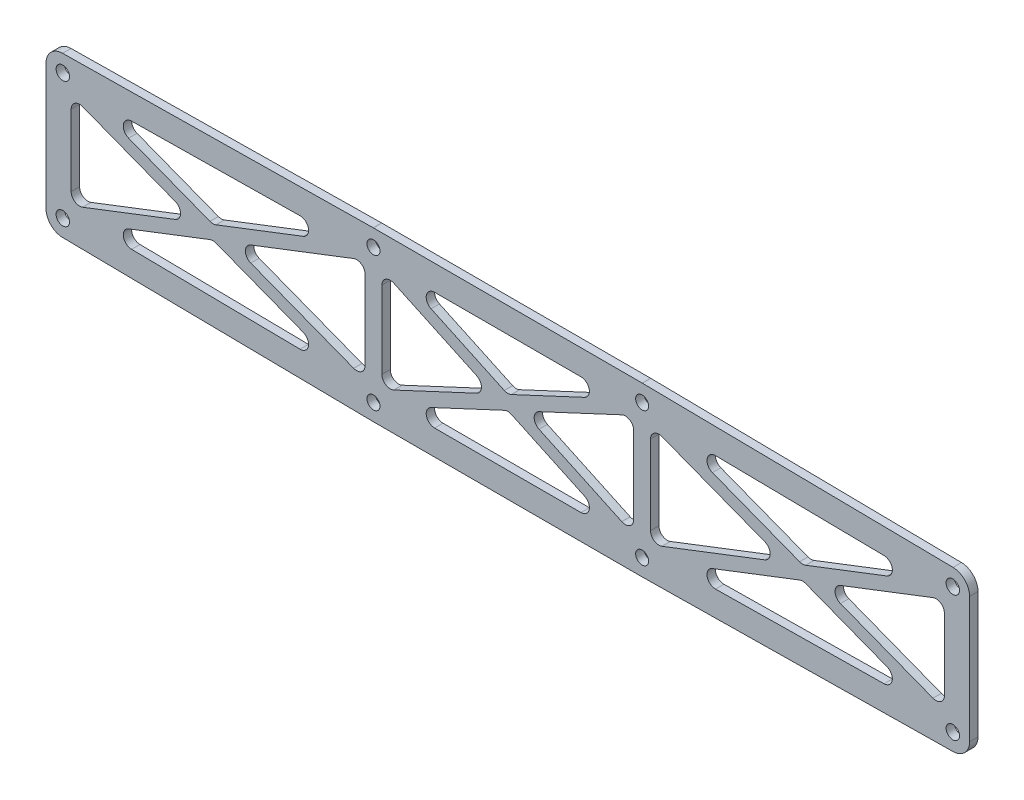
from build123d import *

# Parameters (mm, degrees)
SKETCH_1_W          = 232
SKETCH_1_H          = 52
EXTRUDE_1_DEPTH     = 2
SKETCH_3_R          = 1.55
CUT_EXTRUDE_2_DEPTH = 10
FILLET_1_R          = 3
SKETCH_8_R          = 1.6
CUT_EXTRUDE_6_DEPTH = 10
CUT_EXTRUDE_7_DEPTH = 5
CUT_EXTRUDE_8_DEPTH = 5
FILLET_2_R          = 2


with BuildPart() as part:
    # 草图1 → 凸台-拉伸1 (new body)
    with BuildSketch(Plane.XY):
        Rectangle(SKETCH_1_W, SKETCH_1_H)
    extrude(amount=EXTRUDE_1_DEPTH)

    # 草图3 → 切除-拉伸2 (cut)
    with BuildSketch(Plane.XY.offset(2)):
        with Locations((32, -16)):
            Circle(SKETCH_3_R)
        with Locations((32, 16)):
            Circle(SKETCH_3_R)
        with Locations((-32, 16)):
            Circle(SKETCH_3_R)
        with Locations((-32, -16)):
            Circle(SKETCH_3_R)
    extrude(amount=-CUT_EXTRUDE_2_DEPTH, mode=Mode.SUBTRACT)

    # 圆角1
    fillet_1_edges = [part.edges().sort_by_distance(p)[0] for p in [
        (116, -26, 1),
        (-116, -26, 1),
        (-116, 26, 1),
        (116, 26, 1),
    ]]
    fillet(fillet_1_edges, radius=FILLET_1_R)

    # 草图8 → 切除-拉伸6 (cut)
    with BuildSketch(Plane.XY.offset(2)):
        with Locations((-106, 15)):
            Circle(SKETCH_8_R)
        with Locations((-106, -15)):
            Circle(SKETCH_8_R)
    cut_extrude_6 = extrude(amount=-CUT_EXTRUDE_6_DEPTH, mode=Mode.SUBTRACT)

    # 镜向1: 切除-拉伸6 across plane
    add(cut_extrude_6.mirror(Plane(origin=(0, 0, 0), x_dir=(0, 0, 1), z_dir=(1, 0, 0))), mode=Mode.SUBTRACT)

    # 草图9 → 切除-拉伸7 (cut, symmetric)
    with BuildSketch(Plane.XY.offset(2)):
        with BuildLine():
            ThreePointArc((-116, -23), (-115.121320344, -25.121320344), (-113, -26))
            Line((-113, -26), (113, -26))
            ThreePointArc((113, -26), (115.121320344, -25.121320344), (116, -23))
            Line((116, -23), (116, 23))
            ThreePointArc((116, 23), (115.121320344, 25.121320344), (113, 26))
            Line((113, 26), (-113, 26))
            ThreePointArc((-113, 26), (-115.121320344, 25.121320344), (-116, 23))
            Line((-116, 23), (-116, -23))
        make_face()
        with BuildLine():
            Line((-110, -15), (-110, 15))
            ThreePointArc((-110, 15), (-108.847472254, 17.809252883), (-106.054049119, 18.99963482))
            Line((-106.054049119, 18.99963482), (-32.054049119, 19.99963482))
            ThreePointArc((-32.054049119, 19.99963482), (-32.027025176, 19.999908704), (-32, 20))
            Line((-32, 20), (32, 20))
            ThreePointArc((32, 20), (32.027025176, 19.999908704), (32.054049119, 19.99963482))
            Line((32.054049119, 19.99963482), (106.054049119, 18.99963482))
            ThreePointArc((106.054049119, 18.99963482), (108.847472254, 17.809252883), (110, 15))
            Line((110, 15), (110, -15))
            ThreePointArc((110, -15), (108.847472254, -17.809252883), (106.054049119, -18.99963482))
            Line((106.054049119, -18.99963482), (32.054049119, -19.99963482))
            ThreePointArc((32.054049119, -19.99963482), (32.027025176, -19.999908704), (32, -20))
            Line((32, -20), (-32, -20))
            ThreePointArc((-32, -20), (-32.027025176, -19.999908704), (-32.054049119, -19.99963482))
            Line((-32.054049119, -19.99963482), (-106.054049119, -18.99963482))
            ThreePointArc((-106.054049119, -18.99963482), (-108.847472254, -17.809252883), (-110, -15))
        make_face(mode=Mode.SUBTRACT)
    extrude(amount=CUT_EXTRUDE_7_DEPTH, both=True, mode=Mode.SUBTRACT)

    # 草图10 → 切除-拉伸8 (cut, symmetric)
    with BuildSketch(Plane.XY.offset(2)):
        Polygon((-70.226242813, 1.607711368), (-38.319534037, 13.914418285), (-99.972894719, 13.081264762), align=None)
        Polygon((-104, -11.419133052), (-74.394439777, 0), (-104, 11.419133052), align=None)
        Polygon((-38.319534037, -13.914418285), (-70.226242813, -1.607711368), (-99.972894719, -13.081264762), align=None)
        Polygon((-34, -12.365078998), (-34, 12.365078998), (-66.058045849, 0), align=None)
        Polygon((-30, -12.344705464), (-3.547059719, 0), (-30, 12.344705464), align=None)
        Polygon((-26.452940281, 14), (0, 1.655294536), (26.452940281, 14), align=None)
        Polygon((3.547059719, 0), (30, -12.344705464), (30, 12.344705464), align=None)
        Polygon((34, -12.365078998), (66.058045849, 0), (34, 12.365078998), align=None)
        Polygon((70.226242813, 1.607711368), (99.972894719, 13.081264762), (38.319534037, 13.914418285), align=None)
        Polygon((104, 11.419133052), (74.394439777, 0), (104, -11.419133052), align=None)
        Polygon((99.972894719, -13.081264762), (70.226242813, -1.607711368), (38.319534037, -13.914418285), align=None)
        Polygon((-26.452940281, -14), (26.452940281, -14), (0, -1.655294536), align=None)
    extrude(amount=CUT_EXTRUDE_8_DEPTH, both=True, mode=Mode.SUBTRACT)

    # 圆角2
    fillet_2_edges = [part.edges().sort_by_distance(p)[0] for p in [
        (34, -12.365078998, 1),
        (34, 12.365078998, 1),
        (66.058045849, 0, 1),
        (38.319534037, 13.914418285, 1),
        (99.972894719, 13.081264762, 1),
        (70.226242813, 1.607711368, 1),
        (26.452940281, 14, 1),
        (0, 1.655294536, 1),
        (-26.452940281, 14, 1),
        (30, 12.344705464, 1),
        (30, -12.344705464, 1),
        (3.547059719, 0, 1),
        (-70.226242813, -1.607711368, 1),
        (-38.319534037, -13.914418285, 1),
        (-99.972894719, -13.081264762, 1),
        (-104, -11.419133052, 1),
        (-104, 11.419133052, 1),
        (-74.394439777, 0, 1),
        (-66.058045849, 0, 1),
        (-34, 12.365078998, 1),
        (-34, -12.365078998, 1),
        (-3.547059719, 0, 1),
        (-30, -12.344705464, 1),
        (-30, 12.344705464, 1),
        (99.972894719, -13.081264762, 1),
        (38.319534037, -13.914418285, 1),
        (70.226242813, -1.607711368, 1),
        (104, 11.419133052, 1),
        (104, -11.419133052, 1),
        (74.394439777, 0, 1),
        (0, -1.655294536, 1),
        (26.452940281, -14, 1),
        (-26.452940281, -14, 1),
        (-99.972894719, 13.081264762, 1),
        (-38.319534037, 13.914418285, 1),
        (-70.226242813, 1.607711368, 1),
    ]]
    fillet(fillet_2_edges, radius=FILLET_2_R)


solid = part.part
